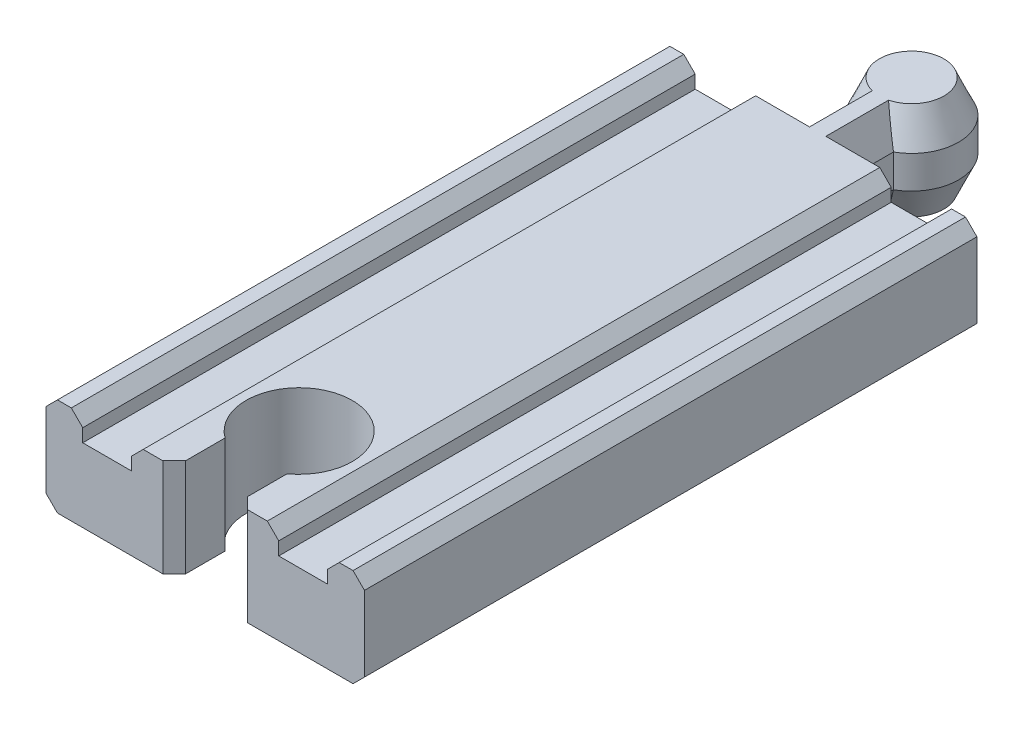
from build123d import *
from OCP.BRepFilletAPI import BRepFilletAPI_MakeChamfer

# Parameters (mm, degrees)
BOSS_EXTRUDE1_DEPTH = 37.5
CUT_EXTRUDE1_DEPTH  = 44.937455548
CHAMFER1_SIZE       = 1.4
BOSS_EXTRUDE2_DEPTH = 12
CHAMFER2_SIZE       = 4
CHAMFER2_SIZE2      = 1.8


with BuildPart() as part:
    # Sketch2 → Boss-Extrude1 (new, symmetric)
    with BuildSketch(Plane.XY):
        Polygon((-19.5, 0), (19.5, 0), (19.5, 12), (15, 12), (15, 9), (9, 9), (9, 12), (-9, 12), (-9, 9), (-15, 9), (-15, 12), (-19.5, 12), align=None)
    extrude(amount=BOSS_EXTRUDE1_DEPTH, both=True)

    # Sketch3 → Cut-Extrude1 (cut, through all)
    with BuildSketch(Plane(origin=(0, 12, 0), x_dir=(1, 0, 0), z_dir=(0, 1, 0))):
        with BuildLine():
            ThreePointArc((-3.8, -31.273518749), (0, -32.5), (3.8, -31.273518749))
            Line((3.8, -31.273518749), (3.8, -26))
            Line((3.8, -26), (-3.8, -26))
            Line((-3.8, -26), (-3.8, -31.273518749))
        make_face()
        with BuildLine():
            Line((3.8, -26), (3.8, -31.273518749))
            ThreePointArc((3.8, -31.273518749), (5.785758377, -28.962262649), (6.5, -26))
            ThreePointArc((6.5, -26), (-2.962262649, -20.214241623), (-3.8, -31.273518749))
            Line((-3.8, -31.273518749), (-3.8, -26))
            Line((-3.8, -26), (3.8, -26))
        make_face()
        with BuildLine():
            Line((-3.8, -37.5), (3.8, -37.5))
            Line((3.8, -37.5), (3.8, -31.273518749))
            ThreePointArc((3.8, -31.273518749), (0, -32.5), (-3.8, -31.273518749))
            Line((-3.8, -31.273518749), (-3.8, -37.5))
        make_face()
    extrude(amount=-CUT_EXTRUDE1_DEPTH, mode=Mode.SUBTRACT)

    # Chamfer1
    chamfer1_edges = [part.edges().sort_by_distance(p)[0] for p in [
        (-19.5, 12, 0),
        (-15, 12, 0),
        (-9, 12, 0),
        (9, 12, 0),
        (15, 12, 0),
        (19.5, 12, 0),
        (19.5, 0, 0),
        (-19.5, 0, 0),
        (3.8, 6, 37.5),
        (-3.8, 6, 37.5),
    ]]
    chamfer(chamfer1_edges, length=CHAMFER1_SIZE)

    # Sketch4 → Boss-Extrude2 (add)
    with BuildSketch(Plane(origin=(0, 12, 0), x_dir=(1, 0, 0), z_dir=(0, 1, 0))):
        with BuildLine():
            Line((-2.8, 43.977799287), (-2.8, 49))
            Line((-2.8, 49), (2.8, 49))
            Line((2.8, 49), (2.8, 43.977799287))
            ThreePointArc((2.8, 43.977799287), (4.957948164, 46.087741426), (5.75, 49))
            ThreePointArc((5.75, 49), (-2.912258574, 53.957948164), (-2.8, 43.977799287))
        make_face()
        with BuildLine():
            Line((2.8, 49), (-2.8, 49))
            Line((-2.8, 49), (-2.8, 43.977799287))
            ThreePointArc((-2.8, 43.977799287), (0, 43.25), (2.8, 43.977799287))
            Line((2.8, 43.977799287), (2.8, 49))
        make_face()
        with BuildLine():
            ThreePointArc((2.8, 43.977799287), (0, 43.25), (-2.8, 43.977799287))
            Line((-2.8, 43.977799287), (-2.8, 37.5))
            Line((-2.8, 37.5), (2.8, 37.5))
            Line((2.8, 37.5), (2.8, 43.977799287))
        make_face()
    extrude(amount=-BOSS_EXTRUDE2_DEPTH)

    # Chamfer2: one chamfer whose edges measure the first distance from different faces: ONE call of the kernel's chamfer builder (chamfer() names one face for all edges)
    chamfer2_edges_1 = [part.edges().sort_by_distance(p)[0] for p in [
        (2.8, 0, -40.738899644),
        (2.8, 12, -40.738899644),
    ]]
    chamfer2_side_1 = [part.faces().sort_by_distance(p)[0] for p in [
        (2.8, 6, -40.738899644),
    ]]
    chamfer2_edges_2 = [part.edges().sort_by_distance(p)[0] for p in [
        (0, 12, -54.75),
        (0, 0, -54.75),
    ]]
    chamfer2_side_2 = [part.faces().sort_by_distance(p)[0] for p in [
        (0, 6, -54.75),
    ]]
    chamfer2_edges_3 = [part.edges().sort_by_distance(p)[0] for p in [
        (-2.8, 12, -40.738899644),
        (-2.8, 0, -40.738899644),
    ]]
    chamfer2_side_3 = [part.faces().sort_by_distance(p)[0] for p in [
        (-2.8, 6, -40.738899644),
    ]]
    chamfer2 = BRepFilletAPI_MakeChamfer(part.part.solid().wrapped)
    for e in chamfer2_edges_1:
        chamfer2.Add(CHAMFER2_SIZE, CHAMFER2_SIZE2, e.wrapped, chamfer2_side_1[0].wrapped)  # the first distance lies on this face
    for e in chamfer2_edges_2:
        chamfer2.Add(CHAMFER2_SIZE, CHAMFER2_SIZE2, e.wrapped, chamfer2_side_2[0].wrapped)  # the first distance lies on this face
    for e in chamfer2_edges_3:
        chamfer2.Add(CHAMFER2_SIZE, CHAMFER2_SIZE2, e.wrapped, chamfer2_side_3[0].wrapped)  # the first distance lies on this face
    add(Compound.cast(chamfer2.Shape()), mode=Mode.REPLACE)


solid = part.part
